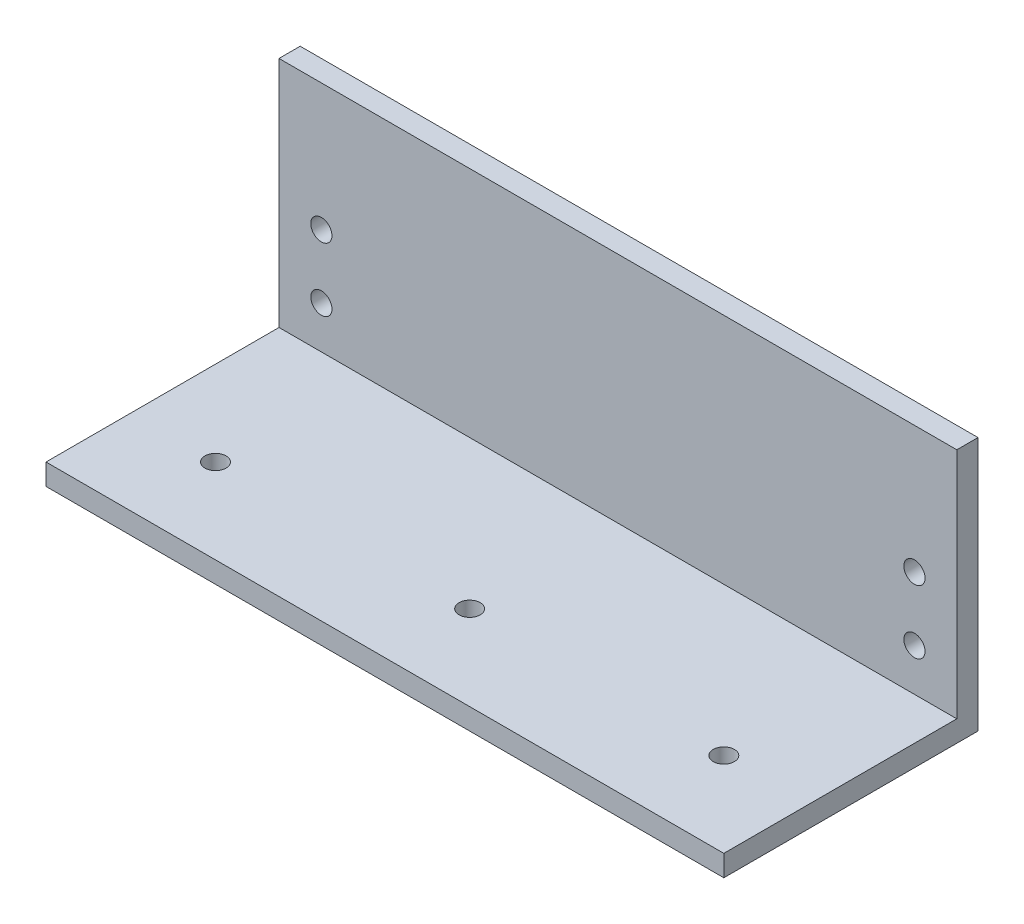
from build123d import *

# Parameters (mm, degrees)
BOSS_EXTRUDE2_DEPTH = 203.2
SKETCH4_R           = 3.175
CUT_EXTRUDE1_DEPTH  = 71.628
SKETCH5_R           = 3.175
CUT_EXTRUDE2_DEPTH  = 244.602


with BuildPart() as part:
    # Sketch2 → Boss-Extrude2 (new body)
    with BuildSketch(Plane(origin=(0, 0, 0), x_dir=(0, 0, -1), z_dir=(1, 0, 0))):
        Polygon((0, 6.35), (0, 0), (76.2, 0), (76.2, 76.2), (69.85, 76.2), (69.85, 6.35), align=None)
    extrude(amount=BOSS_EXTRUDE2_DEPTH)

    # Sketch4 → Cut-Extrude1 (cut)
    with BuildSketch(Plane(origin=(0, 0, -76.2), x_dir=(-1, 0, 0), z_dir=(0, 0, -1))):
        with Locations((-190.5, 19.05)):
            Circle(SKETCH4_R)
        with Locations((-190.5, 38.1)):
            Circle(SKETCH4_R)
        with Locations((-12.7, 19.05)):
            Circle(SKETCH4_R)
        with Locations((-12.7, 38.1)):
            Circle(SKETCH4_R)
    extrude(amount=-CUT_EXTRUDE1_DEPTH, mode=Mode.SUBTRACT)

    # Sketch5 → Cut-Extrude2 (cut)
    with BuildSketch(Plane(origin=(0, 6.35, 0), x_dir=(1, 0, 0), z_dir=(0, 1, 0))):
        with Locations(Location((25.4, 25.4, 0), (0, 0, 270))):
            Circle(SKETCH5_R)
        with Locations(Location((177.8, 25.4, 0), (0, 0, 270))):
            Circle(SKETCH5_R)
        with Locations(Location((101.6, 25.4, 0), (0, 0, 270))):
            Circle(SKETCH5_R)
    extrude(amount=-CUT_EXTRUDE2_DEPTH, mode=Mode.SUBTRACT)


solid = part.part
